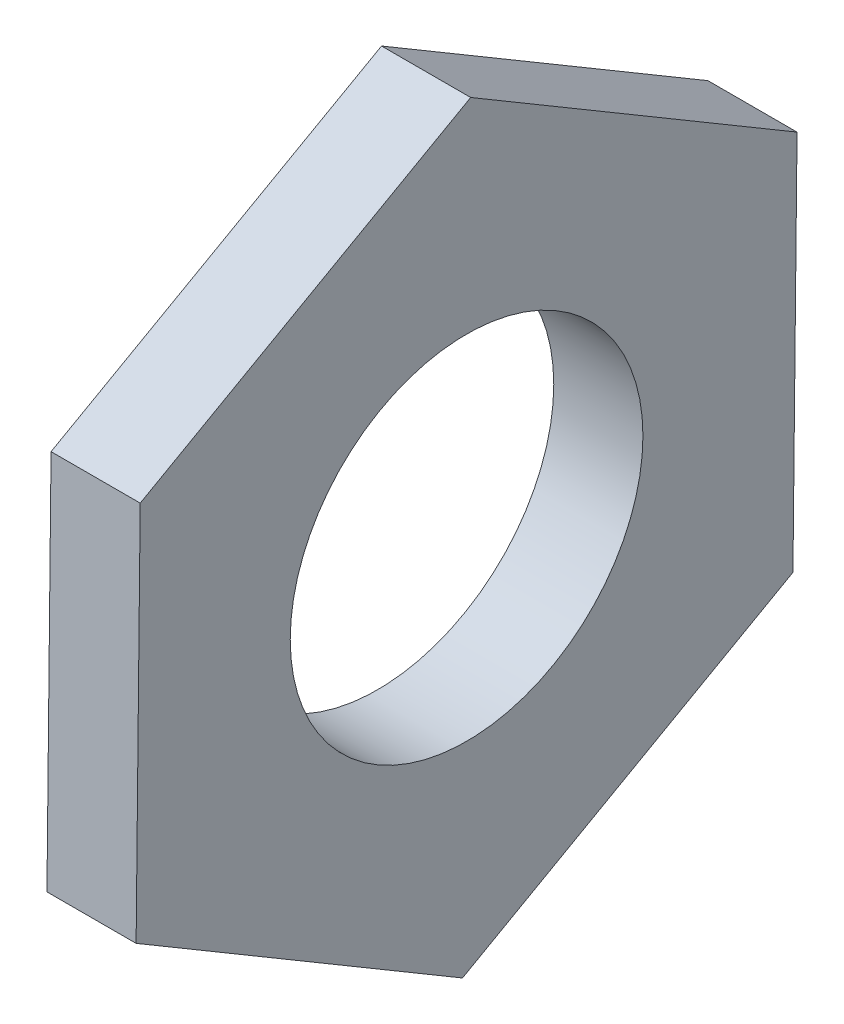
from build123d import *

# Parameters (mm, degrees)
BOSS_EXTRUDE1_DEPTH     = 12.7
CUT_EXTRUDE1_DEPTH      = 73.765244725
CUT_EXTRUDE1_DEPTH_BACK = 73.765244725
SKETCH5_R               = 25.120382551


with BuildPart() as part:
    # Sketch4 → Boss-Extrude1 (new body)
    with BuildSketch(Plane(origin=(0, 0, 0), x_dir=(0, 0, -1), z_dir=(1, 0, 0))):
        Polygon((-47.071700205, -26.501749912), (-0.584661434, -54.016163133), (46.487038771, -27.514413221), (47.071700205, 26.501749912), (0.584661434, 54.016163133), (-46.487038771, 27.514413221), align=None)
    extrude(amount=BOSS_EXTRUDE1_DEPTH)

    # Sketch5 → Cut-Extrude1 (cut, two sides: drawn at the far end of the back side and taken through both)
    with BuildSketch(Plane(origin=(12.7, 0, 0), x_dir=(0, 0, -1), z_dir=(1, 0, 0)).offset(-CUT_EXTRUDE1_DEPTH_BACK)):
        Circle(SKETCH5_R)
    extrude(amount=CUT_EXTRUDE1_DEPTH + CUT_EXTRUDE1_DEPTH_BACK, mode=Mode.SUBTRACT)


solid = part.part
